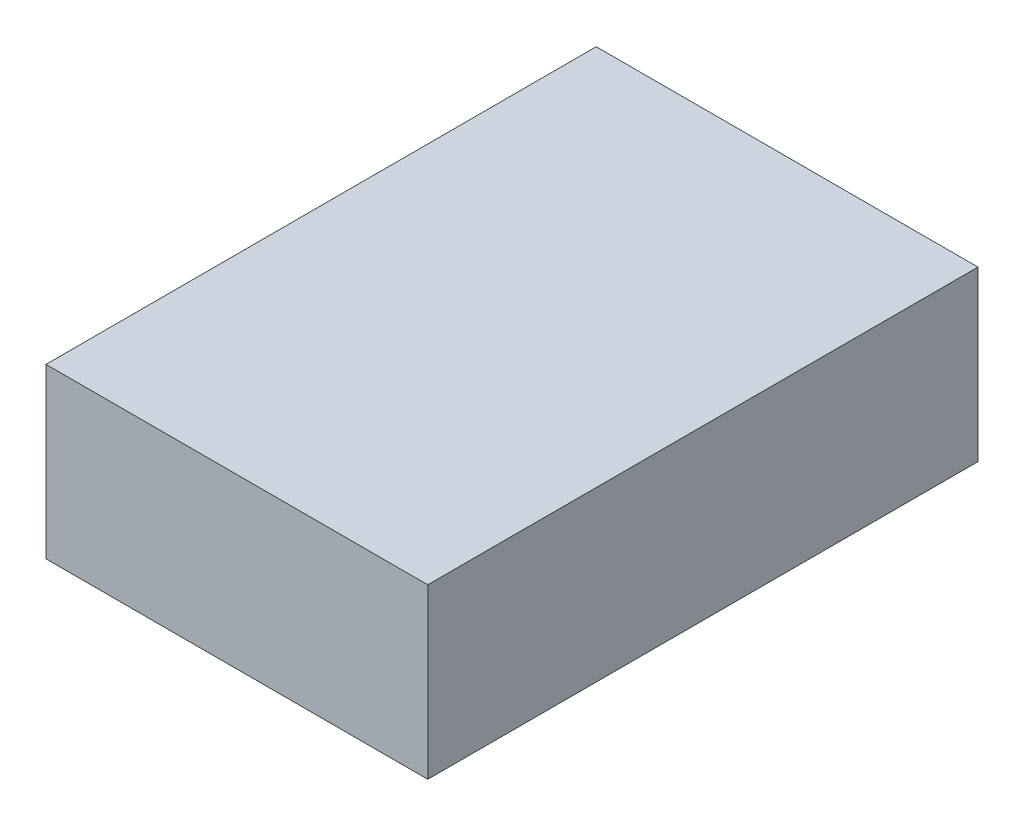
from build123d import *

# Parameters (mm, degrees)
SKETCH1_W           = 16.998269896
SKETCH1_H           = 7.5
BOSS_EXTRUDE1_DEPTH = 24.5


with BuildPart() as part:
    # Sketch1 → Boss-Extrude1 (new body)
    with BuildSketch(Plane.XY):
        with Locations((8.499134948, 3.75)):
            Rectangle(SKETCH1_W, SKETCH1_H)
    extrude(amount=BOSS_EXTRUDE1_DEPTH)


solid = part.part
